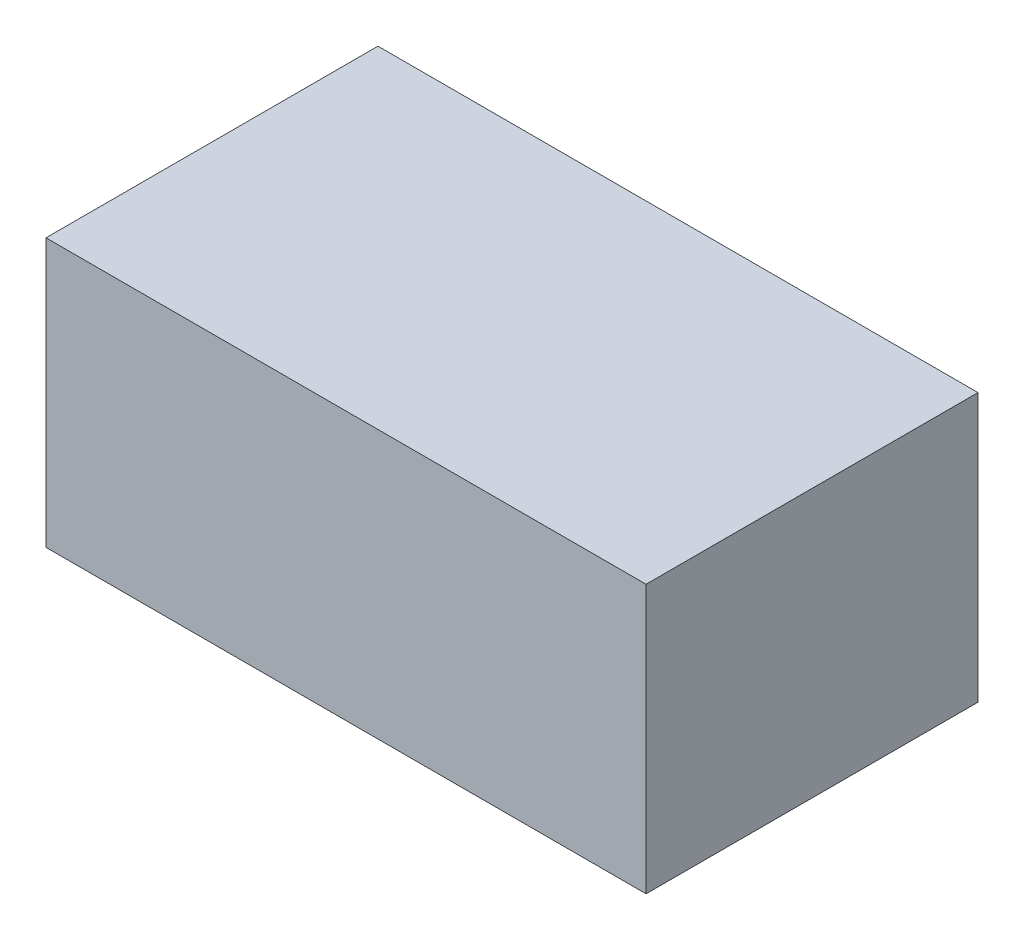
from build123d import *

# Parameters (mm, degrees)
SKETCH1_W           = 47
SKETCH1_H           = 26
BOSS_EXTRUDE1_DEPTH = 21


with BuildPart() as part:
    # Sketch1 → Boss-Extrude1 (new body)
    with BuildSketch(Plane(origin=(0, 0, 0), x_dir=(1, 0, 0), z_dir=(0, 1, 0))):
        Rectangle(SKETCH1_W, SKETCH1_H)
    extrude(amount=BOSS_EXTRUDE1_DEPTH)


solid = part.part
